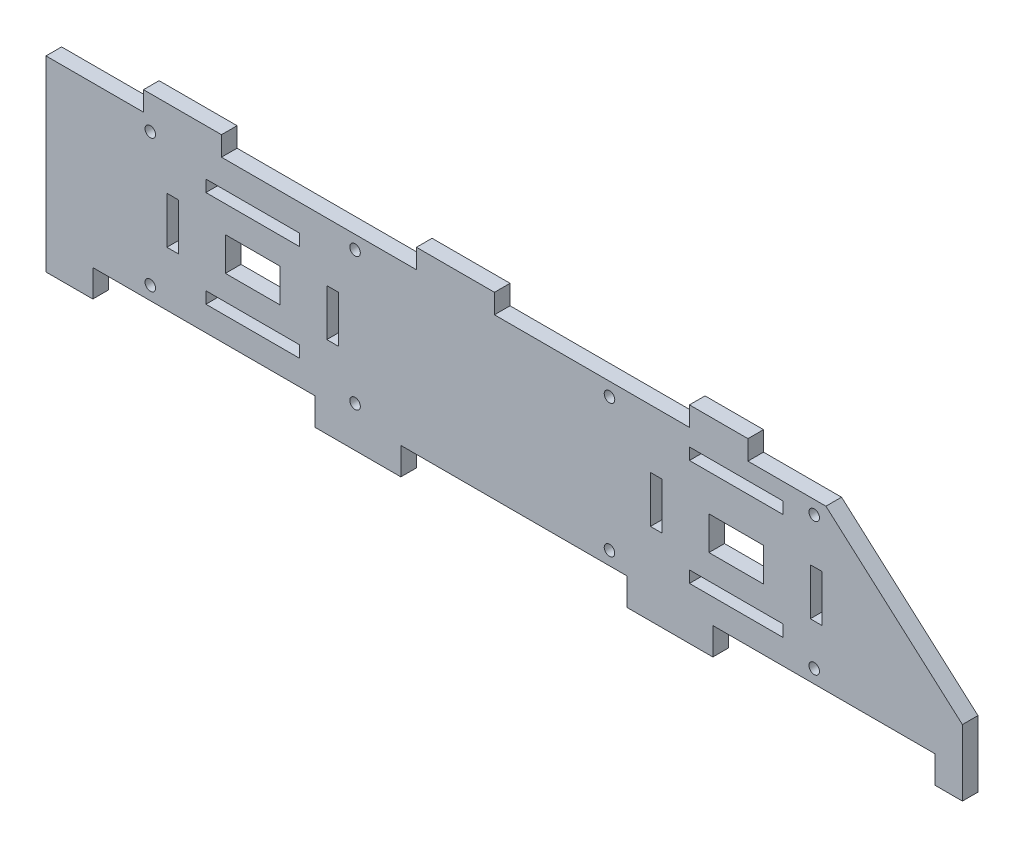
from build123d import *

# Parameters (mm, degrees)
BOSS_EXTRUDE2_DEPTH = 4
CUT_EXTRUDE1_DEPTH  = 4
SKETCH4_R           = 1.35
CUT_EXTRUDE2_DEPTH  = 4
SKETCH6_W           = 24
SKETCH6_H           = 3
CUT_EXTRUDE3_DEPTH  = 4


with BuildPart() as part:
    # Sketch1 → Boss-Extrude2 (new body)
    with BuildSketch(Plane.XY):
        Polygon((-105.5, 0), (-48.5, 0), (-48.5, -7), (-26.5, -7), (-26.5, 0), (31.5, 0), (31.5, -7), (53.5, -7), (53.5, 0), (110.5, 0), (110.5, -7), (117.5, -7), (117.5, 0), (117.5, 10), (82.5, 41), (62.5, 41), (62.5, 46), (47.5, 46), (47.5, 41), (-2.5, 41), (-2.5, 46), (-22.5, 46), (-22.5, 41), (-72.5, 41), (-72.5, 46), (-92.5, 46), (-92.5, 41), (-117.5, 41), (-117.5, 0), (-117.5, -7), (-105.5, -7), align=None)
    extrude(amount=BOSS_EXTRUDE2_DEPTH)

    # Sketch2 → Cut-Extrude1 (cut)
    with BuildSketch(Plane.XY.offset(4)):
        Polygon((-71.5, 20), (-71.5, 24.3), (-57.5, 24.3), (-57.5, 15.7), (-71.5, 15.7), align=None)
        Polygon((52.5, 20), (52.5, 24.3), (66.5, 24.3), (66.5, 15.7), (52.5, 15.7), align=None)
    extrude(amount=-CUT_EXTRUDE1_DEPTH, mode=Mode.SUBTRACT)

    # Sketch4 → Cut-Extrude2 (cut)
    with BuildSketch(Plane.XY.offset(4)):
        with Locations((-38.25, 37.55)):
            Circle(SKETCH4_R)
        with Locations((-90.75, 37.55)):
            Circle(SKETCH4_R)
        with Locations((-90.75, 3.45)):
            Circle(SKETCH4_R)
        with Locations((-38.25, 3.45)):
            Circle(SKETCH4_R)
        with Locations((27, 37.55)):
            Circle(SKETCH4_R)
        with Locations((79.5, 37.55)):
            Circle(SKETCH4_R)
        with Locations((79.5, 3.45)):
            Circle(SKETCH4_R)
        with Locations((27, 3.45)):
            Circle(SKETCH4_R)
    extrude(amount=-CUT_EXTRUDE2_DEPTH, mode=Mode.SUBTRACT)

    # Sketch6 → Cut-Extrude3 (cut)
    with BuildSketch(Plane.XY.offset(4)):
        with Locations((-64.5, 32.65)):
            Rectangle(SKETCH6_W, SKETCH6_H)
        with Locations((-64.5, 7.85)):
            Rectangle(SKETCH6_W, SKETCH6_H)
        with Locations((59.5, 35.15)):
            Rectangle(SKETCH6_W, SKETCH6_H)
        with Locations((59.5, 7.85)):
            Rectangle(SKETCH6_W, SKETCH6_H)
        Polygon((-83.5, 20), (-83.5, 26), (-86.5, 26), (-86.5, 14), (-83.5, 14), align=None)
        Polygon((-45.5, 20), (-45.5, 26), (-42.5, 26), (-42.5, 14), (-45.5, 14), align=None)
        Polygon((40.5, 20), (40.5, 26), (37.5, 26), (37.5, 14), (40.5, 14), align=None)
        Polygon((78.5, 20), (78.5, 26), (81.5, 26), (81.5, 14), (78.5, 14), align=None)
    extrude(amount=-CUT_EXTRUDE3_DEPTH, mode=Mode.SUBTRACT)


solid = part.part
